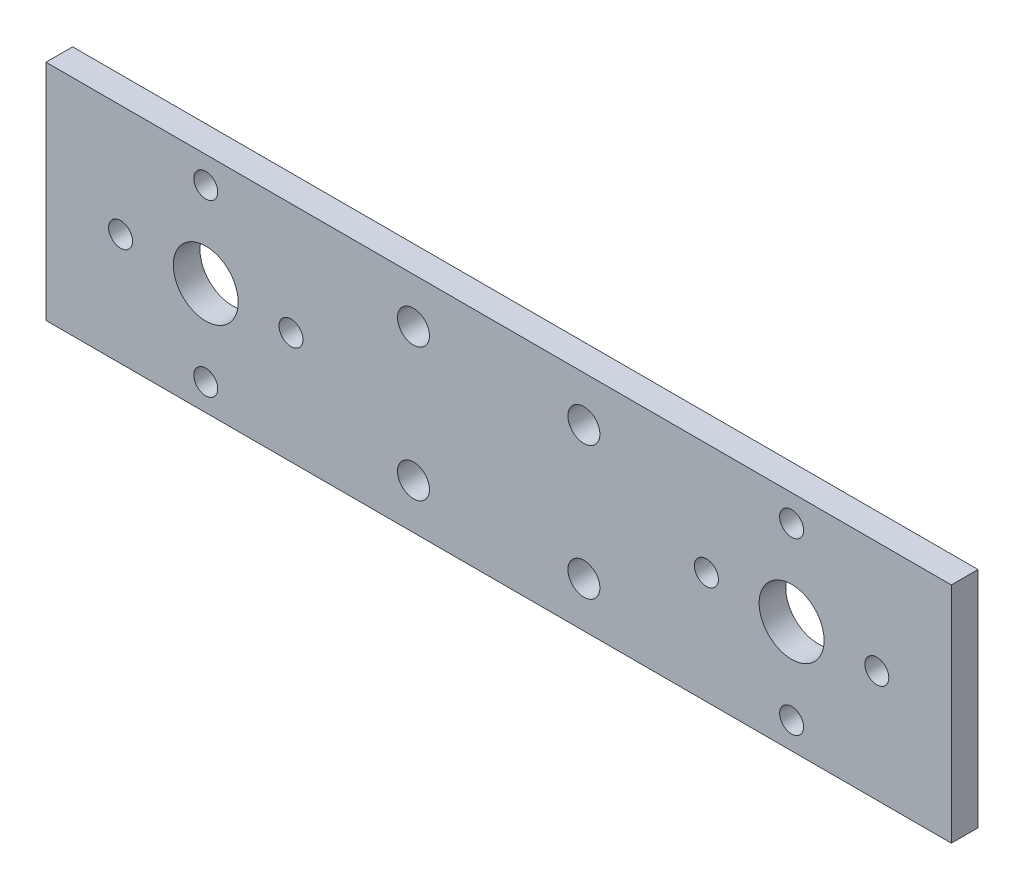
from build123d import *

# Parameters (mm, degrees)
SKETCH1_W               = 170
SKETCH1_H               = 42
BOSS_EXTRUDE1_DEPTH     = 5
CUT_EXTRUDE1_DEPTH      = 88.698346621
CUT_EXTRUDE1_DEPTH_BACK = 88.698346621
SKETCH2_R               = 6.1
CUT_EXTRUDE2_DEPTH      = 88.698346621
CUT_EXTRUDE2_DEPTH_BACK = 88.698346621
SKETCH3_R               = 3
SKETCH4_R               = 2.25
CUT_EXTRUDE3_DEPTH      = 88.698346621


with BuildPart() as part:
    # Sketch1 → Boss-Extrude1 (new body)
    with BuildSketch(Plane.XY):
        Rectangle(SKETCH1_W, SKETCH1_H)
    extrude(amount=BOSS_EXTRUDE1_DEPTH)

    # Sketch2 → Cut-Extrude1 (cut, two sides: drawn at the far end of the back side and taken through both)
    with BuildSketch(Plane.XY.offset(5).offset(-CUT_EXTRUDE1_DEPTH_BACK)):
        with Locations((-55, 0)):
            Circle(SKETCH2_R)
        with Locations((55, 0)):
            Circle(SKETCH2_R)
    extrude(amount=CUT_EXTRUDE1_DEPTH + CUT_EXTRUDE1_DEPTH_BACK, mode=Mode.SUBTRACT)

    # Sketch3 → Cut-Extrude2 (cut, two sides: drawn at the far end of the back side and taken through both)
    with BuildSketch(Plane.XY.offset(5).offset(-CUT_EXTRUDE2_DEPTH_BACK)):
        with Locations((-16, -12.5)):
            Circle(SKETCH3_R)
        with Locations((-16, 12.5)):
            Circle(SKETCH3_R)
        with Locations((16, 12.5)):
            Circle(SKETCH3_R)
        with Locations((16, -12.5)):
            Circle(SKETCH3_R)
    extrude(amount=CUT_EXTRUDE2_DEPTH + CUT_EXTRUDE2_DEPTH_BACK, mode=Mode.SUBTRACT)

    # Sketch4 → Cut-Extrude3 (cut, through all)
    with BuildSketch(Plane.XY.offset(5)):
        with Locations((-71, 0)):
            Circle(SKETCH4_R)
        with Locations((-55, 16)):
            Circle(SKETCH4_R)
        with Locations((-39, 0)):
            Circle(SKETCH4_R)
        with Locations((-55, -16)):
            Circle(SKETCH4_R)
        with Locations((39, 0)):
            Circle(SKETCH4_R)
        with Locations((55, 16)):
            Circle(SKETCH4_R)
        with Locations((71, 0)):
            Circle(SKETCH4_R)
        with Locations((55, -16)):
            Circle(SKETCH4_R)
    extrude(amount=-CUT_EXTRUDE3_DEPTH, mode=Mode.SUBTRACT)


solid = part.part
